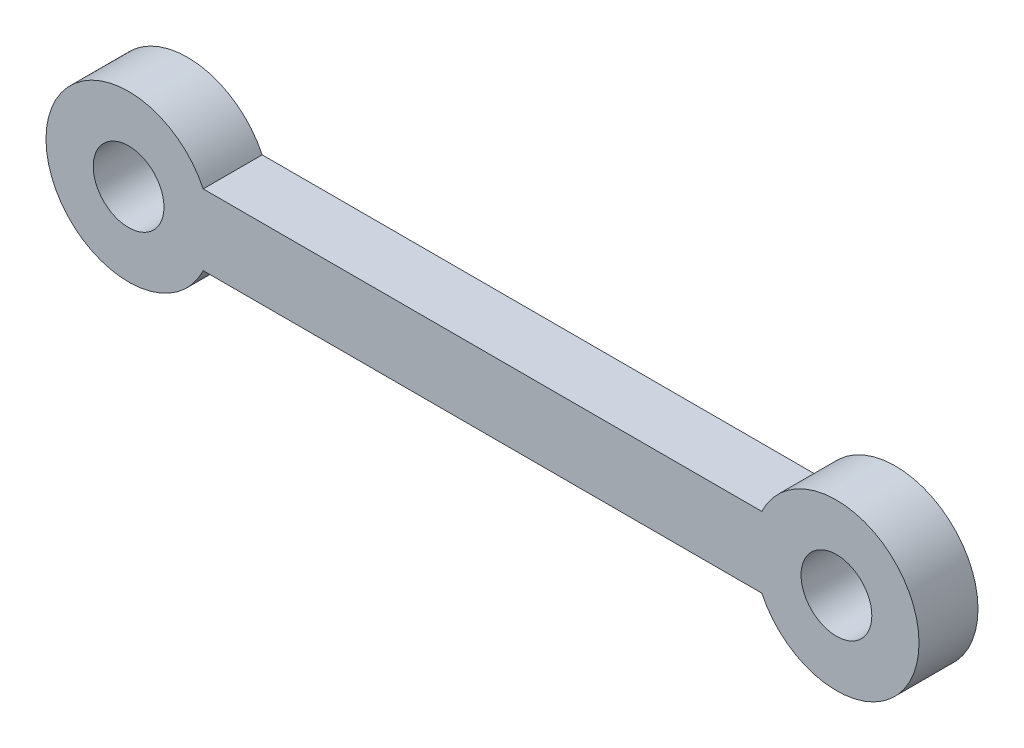
from build123d import *

# Parameters (mm, degrees)
SKETCH1_R           = 1.5
BOSS_EXTRUDE1_DEPTH = 2.5


with BuildPart() as part:
    # Sketch1 → Boss-Extrude1 (new body)
    with BuildSketch(Plane.XY):
        with BuildLine():
            Line((-11.83772234, 1.5), (11.83772234, 1.5))
            ThreePointArc((11.83772234, 1.5), (18.5, 0), (11.83772234, -1.5))
            Line((11.83772234, -1.5), (-11.83772234, -1.5))
            ThreePointArc((-11.83772234, -1.5), (-18.5, 0), (-11.83772234, 1.5))
        make_face()
        with Locations((-15, 0)):
            Circle(SKETCH1_R, mode=Mode.SUBTRACT)
        with Locations((15, 0)):
            Circle(SKETCH1_R, mode=Mode.SUBTRACT)
    extrude(amount=BOSS_EXTRUDE1_DEPTH)


solid = part.part
